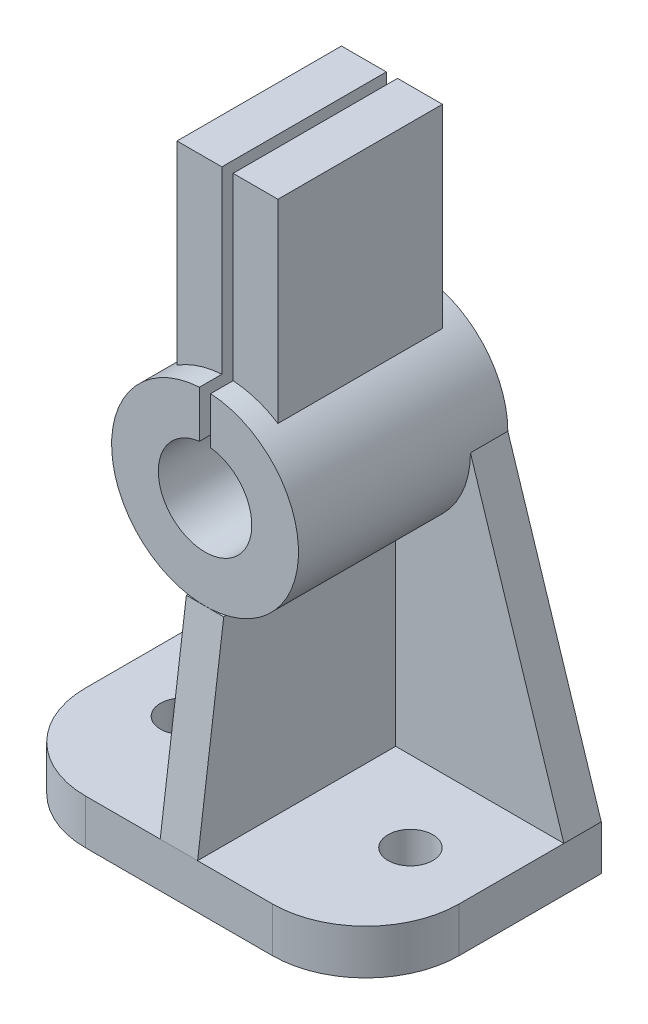
from build123d import *

# Parameters (mm, degrees)
BOSS_EXTRUDE1_DEPTH            = 12
SKETCH3_R                      = 25
SKETCH3_R_2                    = 12.5
BOSS_EXTRUDE2_DEPTH            = 56
BOSS_EXTRUDE5_DEPTH            = 10
CUT_EXTRUDE1_REACH             = 131.295
SKETCH7_R                      = 6
BOSS_EXTRUDE8_DEPTH            = 5
SKETCH10_W                     = 27
SKETCH10_H                     = 44
BOSS_EXTRUDE9_DEPTH            = 48
BOSS_EXTRUDE10_REACH           = 131.295
BOSS_EXTRUDE10_END_RADIUS      = 25
SKETCH11_W                     = 27
SKETCH11_H                     = 44
CUT_EXTRUDE4_REACH             = 131.295
CUT_EXTRUDE4_END_RADIUS        = 12.5
SKETCH14_W                     = 3
SKETCH14_H                     = 58.243976523
CUT_EXTRUDE4_DIRECTION_2_DEPTH = 130.295204861


with BuildPart() as part:
    # Sketch2 → Boss-Extrude1 (new body)
    with BuildSketch(Plane(origin=(0, 0, 0), x_dir=(1, 0, 0), z_dir=(0, 1, 0))):
        with BuildLine():
            Line((-25, -31.5), (25, -31.5))
            ThreePointArc((25, -31.5), (42.67766953, -24.17766953), (50, -6.5))
            Line((50, -6.5), (50, 31.5))
            Line((50, 31.5), (-50, 31.5))
            Line((-50, 31.5), (-50, -6.5))
            ThreePointArc((-50, -6.5), (-42.67766953, -24.17766953), (-25, -31.5))
        make_face()
    extrude(amount=BOSS_EXTRUDE1_DEPTH)



with BuildPart() as body_2:
    # Sketch3 → Boss-Extrude2 (new body)
    with BuildSketch(Plane(origin=(0, 0, -31.5), x_dir=(-1, 0, 0), z_dir=(0, 0, -1))):
        with Locations((0, 90)):
            Circle(SKETCH3_R)
        with Locations((0, 90)):
            Circle(SKETCH3_R_2, mode=Mode.SUBTRACT)
    extrude(amount=-BOSS_EXTRUDE2_DEPTH)


with BuildPart() as part_1:
    add(part.part)

    add(body_2.part)  # Boss-Extrude5 merges body 2
    # Sketch5 → Boss-Extrude5 (add)
    with BuildSketch(Plane(origin=(0, 0, -31.5), x_dir=(-1, 0, 0), z_dir=(0, 0, -1))):
        with BuildLine():
            Line((-25, 90), (-50, 12))
            Line((-50, 12), (50, 12))
            Line((50, 12), (25, 90))
            ThreePointArc((25, 90), (0, 115), (-25, 90))
        make_face()
    extrude(amount=-BOSS_EXTRUDE5_DEPTH)

    # Sketch7 → Cut-Extrude1 (cut, up to next)
    with BuildSketch(Plane(origin=(0, 0, 0), x_dir=(-1, 0, 0), z_dir=(0, -1, 0)), mode=Mode.PRIVATE) as cut_extrude1_sk1:
        with Locations(Location((-30.442997097, 0, 0), (0, 0, 90))):
            Circle(SKETCH7_R)
    cut_extrude1_tool1 = extrude(cut_extrude1_sk1.sketch, amount=-CUT_EXTRUDE1_REACH, mode=Mode.PRIVATE) & part_1.part
    # Sketch7 → Cut-Extrude1 (cut, up to next)
    with BuildSketch(Plane(origin=(0, 0, 0), x_dir=(-1, 0, 0), z_dir=(0, -1, 0)), mode=Mode.PRIVATE) as cut_extrude1_sk2:
        with Locations(Location((30.442997097, 0, 0), (0, 0, 90))):
            Circle(SKETCH7_R)
    cut_extrude1_tool2 = extrude(cut_extrude1_sk2.sketch, amount=-CUT_EXTRUDE1_REACH, mode=Mode.PRIVATE) & part_1.part
    add(cut_extrude1_tool1.solids().sort_by_distance((30.442997, 0, 0))[0], mode=Mode.SUBTRACT)
    add(cut_extrude1_tool2.solids().sort_by_distance((-30.442997, 0, 0))[0], mode=Mode.SUBTRACT)



with BuildPart() as body_2_2:
    # Sketch8 → Boss-Extrude8 (new, symmetric)
    with BuildSketch(Plane.ZY):
        Polygon((24.5, 65), (31.5, 12), (-21.5, 12), (-21.5, 65), align=None)
    extrude(amount=BOSS_EXTRUDE8_DEPTH, both=True)


with BuildPart() as body_3:
    # Sketch10 → Boss-Extrude9 (new body)
    with BuildSketch(Plane(origin=(0, 115, 0), x_dir=(1, 0, 0), z_dir=(0, 1, 0))):
        with Locations((0, 3.5)):
            Rectangle(SKETCH10_W, SKETCH10_H)
    extrude(amount=BOSS_EXTRUDE9_DEPTH)


with BuildPart() as part_2:
    add(part_1.part)

    add(body_3.part)  # Boss-Extrude10 merges body 3
    # Boss-Extrude10: up to this cylinder (the profile starts outside it)
    boss_extrude10_end = Plane(origin=(0, 90, -3.5), z_dir=(0, 0, -1)) * Cylinder(BOSS_EXTRUDE10_END_RADIUS, 313.59, mode=Mode.PRIVATE)
    # Sketch11 → Boss-Extrude10 (add, up to the surface)
    with BuildSketch(Plane.XZ.offset(-115), mode=Mode.PRIVATE) as boss_extrude10_sk1:
        with Locations((0, -3.5)):
            Rectangle(SKETCH11_W, SKETCH11_H)
    boss_extrude10_tool1 = extrude(boss_extrude10_sk1.sketch, amount=BOSS_EXTRUDE10_REACH, mode=Mode.PRIVATE) - boss_extrude10_end
    add(boss_extrude10_tool1.solids().sort_by_distance((0, 115, -3.5))[0])
    add(boss_extrude10_tool1.solids().sort_by_distance((0, 115, -3.5))[1])

    # Cut-Extrude4: up to this cylinder (the profile starts outside it)
    cut_extrude4_end = Plane(origin=(0, 90, -2.378012), z_dir=(0, 0, -1)) * Cylinder(CUT_EXTRUDE4_END_RADIUS, 288.59, mode=Mode.PRIVATE)
    # Sketch14 → Cut-Extrude4 (cut, up to the surface)
    with BuildSketch(Plane(origin=(0, 115, 0), x_dir=(1, 0, 0), z_dir=(0, 1, 0)), mode=Mode.PRIVATE) as cut_extrude4_sk1:
        with Locations((0, 2.378011739)):
            Rectangle(SKETCH14_W, SKETCH14_H)
    cut_extrude4_tool1 = extrude(cut_extrude4_sk1.sketch, amount=-CUT_EXTRUDE4_REACH, mode=Mode.PRIVATE) - cut_extrude4_end
    add(cut_extrude4_tool1.solids().sort_by_distance((0, 115, -2.378012))[0], mode=Mode.SUBTRACT)

    # Sketch14 → Cut-Extrude4 direction 2 (cut)
    with BuildSketch(Plane(origin=(0, 115, 0), x_dir=(1, 0, 0), z_dir=(0, 1, 0))):
        with Locations((0, 2.378011739)):
            Rectangle(SKETCH14_W, SKETCH14_H)
    extrude(amount=CUT_EXTRUDE4_DIRECTION_2_DEPTH, mode=Mode.SUBTRACT)


solid = Compound([body_2_2.part, part_2.part])
